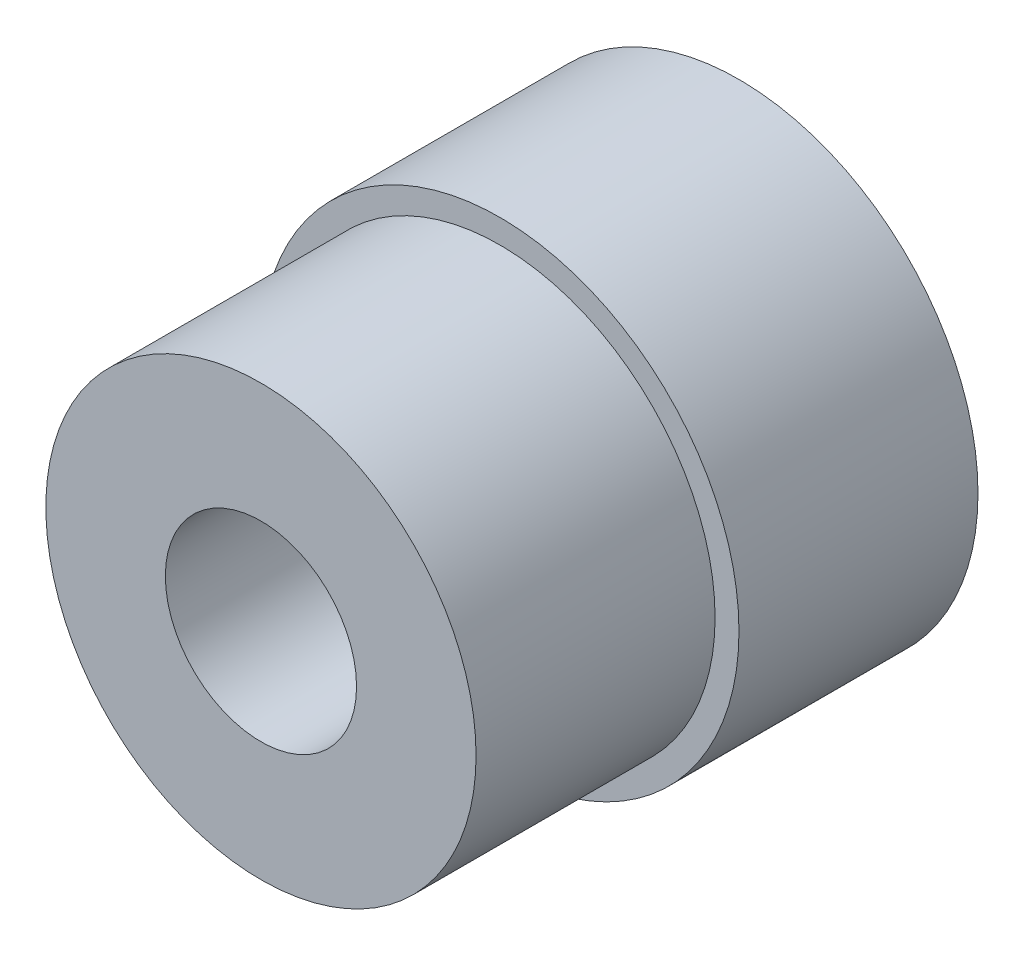
from build123d import *

# Parameters (mm, degrees)
SKETCH_1_R      = 10
EXTRUDE_1_DEPTH = 10
SKETCH_2_R      = 9
SKETCH_2_R_2    = 4
EXTRUDE_2_DEPTH = 10


with BuildPart() as part:
    # 草图1 → 凸台-拉伸1 (new body)
    with BuildSketch(Plane.XY):
        Circle(SKETCH_1_R)
    extrude(amount=EXTRUDE_1_DEPTH)

    # 草图2 → 凸台-拉伸2 (add)
    with BuildSketch(Plane.XY.offset(10)):
        Circle(SKETCH_2_R)
        Circle(SKETCH_2_R_2, mode=Mode.SUBTRACT)
    extrude(amount=EXTRUDE_2_DEPTH)


solid = part.part
